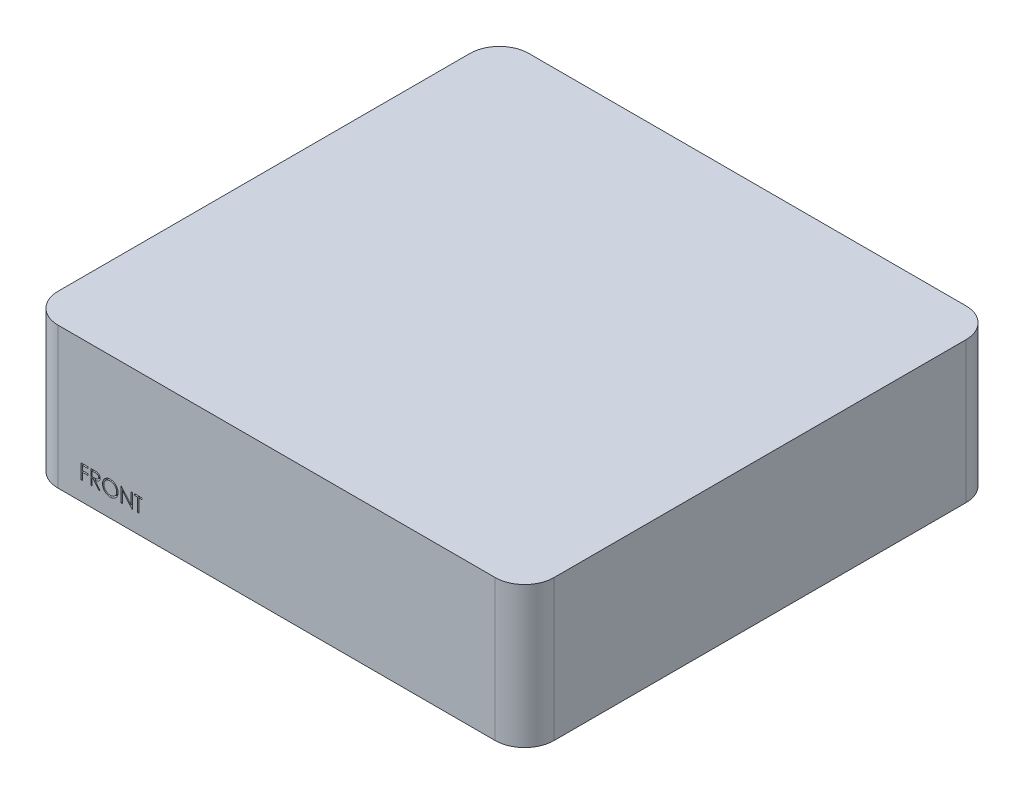
from build123d import *

# Parameters (mm, degrees)
SKETCH1_W           = 118
SKETCH1_H           = 112
BOSS_EXTRUDE1_DEPTH = 33.6
FILLET2_R           = 7
CUT_EXTRUDE1_DEPTH  = 1


with BuildPart() as part:
    # Sketch1 → Boss-Extrude1 (new body)
    with BuildSketch(Plane(origin=(0, 0, 0), x_dir=(1, 0, 0), z_dir=(0, 1, 0))):
        with Locations((59, 56)):
            Rectangle(SKETCH1_W, SKETCH1_H)
    extrude(amount=BOSS_EXTRUDE1_DEPTH)

    # Fillet2
    fillet2_edges = [part.edges().sort_by_distance(p)[0] for p in [
        (118, 16.8, 0),
        (118, 16.8, -112),
        (0, 16.8, -112),
        (0, 16.8, 0),
    ]]
    fillet(fillet2_edges, radius=FILLET2_R)

    # Sketch4 → Cut-Extrude1 (cut)
    # profile 1 of 5: a face of its own
    with BuildSketch(Plane.XY):
        Polygon((12.455172464, 7.97101264), (14.16030067, 7.97101264), (14.16030067, 7.612038281), (12.769275028, 7.612038281), (12.769275028, 6.535115204), (14.16030067, 6.535115204), (14.16030067, 6.176140845), (12.769275028, 6.176140845), (12.769275028, 4.47101264), (12.455172464, 4.47101264), align=None)
    # profile 2 of 5: a face of its own
    with BuildSketch(Plane.XY):
        with BuildLine():
            Line((14.788505798, 7.97101264), (15.488926471, 7.97101264))
            add(Edge.make_bspline(
                [(15.488926471, 7.97101264), (15.535667599, 7.970857054), (15.625415744, 7.970558311), (15.753989014, 7.968892548), (15.870816111, 7.964118193), (15.97583595, 7.960009609), (16.069046605, 7.952517668), (16.150733896, 7.945357021), (16.220521594, 7.93598336), (16.262767445, 7.927277937), (16.281895221, 7.923336358)],
                knots=[0, 0, 0, 0, 1.410062039, 2.707475311, 3.878576406, 4.937260626, 5.877586885, 6.699081471, 7.410979367, 8, 8, 8, 8], degree=3))
            add(Edge.make_bspline(
                [(16.281895221, 7.923336358), (16.307501845, 7.917009592), (16.358168834, 7.904491029), (16.4311189, 7.878031428), (16.500633224, 7.847411803), (16.566423049, 7.811448083), (16.62815884, 7.769873303), (16.686477151, 7.723405181), (16.741642614, 7.672297975), (16.791424244, 7.615263134), (16.838363296, 7.555426624), (16.877951922, 7.490722867), (16.912078402, 7.423061339), (16.939248919, 7.351753922), (16.961126893, 7.27749215), (16.976553132, 7.199603353), (16.98580432, 7.118442378), (16.986746175, 7.063084469), (16.987223746, 7.035015044)],
                knots=[0, 0, 0, 0, 1.027469482, 2.033020251, 3.019912614, 3.986113645, 4.951240523, 5.91722682, 6.890402269, 7.87763091, 8.8651537, 9.85103654, 10.82876324, 11.815024772, 12.821070561, 13.842952187, 14.906261191, 16, 16, 16, 16], degree=3))
            add(Edge.make_bspline(
                [(16.987223746, 7.035015044), (16.985754748, 6.988379939), (16.982888353, 6.897382771), (16.956163249, 6.76532189), (16.912386729, 6.642132575), (16.85206344, 6.527969937), (16.775243964, 6.425059292), (16.682919173, 6.334668836), (16.575037562, 6.259028924), (16.474608246, 6.206576119), (16.385894046, 6.172983211), (16.312860733, 6.149346852), (16.233193756, 6.131084886), (16.147656421, 6.114724755), (16.055892766, 6.10237306), (15.958122726, 6.093326466), (15.854276575, 6.087672417), (15.782937505, 6.086830412), (15.74623817, 6.086397255)],
                knots=[0, 0, 0, 0, 1.260483769, 2.459530307, 3.627416485, 4.787058657, 5.939039949, 7.08810263, 8.267026773, 9.491475466, 10.141966685, 10.831826277, 11.566392101, 12.351337768, 13.187381173, 14.07005841, 15.007169909, 16, 16, 16, 16], degree=3))
            Line((15.74623817, 6.086397255), (17.032095541, 4.47101264))
            Line((17.032095541, 4.47101264), (16.643674067, 4.47101264))
            Line((16.643674067, 4.47101264), (15.357816695, 6.086397255))
            Line((15.357816695, 6.086397255), (15.102608362, 6.086397255))
            Line((15.102608362, 6.086397255), (15.102608362, 4.47101264))
            Line((15.102608362, 4.47101264), (14.788505798, 4.47101264))
            Line((14.788505798, 4.47101264), (14.788505798, 7.97101264))
        make_face()
        with BuildLine():
            Line((15.102608362, 7.612038281), (15.102608362, 6.445371614))
            Line((15.102608362, 6.445371614), (15.743433682, 6.440463762))
            add(Edge.make_bspline(
                [(15.743433682, 6.440463762), (15.773353721, 6.440450525), (15.831347278, 6.440424868), (15.915247943, 6.444418645), (15.993368055, 6.448961963), (16.065408807, 6.455911308), (16.131402382, 6.46486738), (16.191315796, 6.476070364), (16.245246847, 6.489122427), (16.308145386, 6.509324053), (16.378381917, 6.541330071), (16.454713377, 6.58789557), (16.519715715, 6.646464689), (16.574633577, 6.713438145), (16.618763009, 6.787074394), (16.649875063, 6.866490763), (16.669617505, 6.949682361), (16.671946051, 7.006860469), (16.673121182, 7.035716165)],
                knots=[0, 0, 0, 0, 1.146690395, 2.22261258, 3.21895312, 4.145990853, 4.996080663, 5.770904154, 6.481378293, 7.121626537, 8.300444488, 9.431385265, 10.535395872, 11.636531494, 12.74115979, 13.810798291, 14.895190096, 16, 16, 16, 16], degree=3))
            add(Edge.make_bspline(
                [(16.673121182, 7.035716165), (16.671919061, 7.063862739), (16.669536896, 7.119638978), (16.650088127, 7.201294888), (16.617198746, 7.278361838), (16.572876508, 7.350526323), (16.518877353, 7.416032059), (16.45555954, 7.472079212), (16.384654345, 7.518328677), (16.318383147, 7.547883057), (16.259148934, 7.566002911), (16.207719274, 7.578754074), (16.149607797, 7.588998543), (16.084532338, 7.597206604), (16.012770707, 7.604261548), (15.933960056, 7.609013327), (15.848623276, 7.611827191), (15.789476345, 7.61196628), (15.758858362, 7.612038281)],
                knots=[0, 0, 0, 0, 1.101028733, 2.181837193, 3.264309656, 4.369019818, 5.486613113, 6.575447106, 7.666700264, 8.788928104, 9.402425223, 10.0903467, 10.862060571, 11.710948788, 12.657782767, 13.684531032, 14.801375019, 16, 16, 16, 16], degree=3))
            Line((15.758858362, 7.612038281), (15.102608362, 7.612038281))
        make_face(mode=Mode.SUBTRACT)
    # profile 3 of 5: a face of its own
    with BuildSketch(Plane.XY):
        with BuildLine():
            add(Edge.make_bspline(
                [(19.387864772, 8.060756229), (19.452672878, 8.05911475), (19.579961345, 8.055890749), (19.767036243, 8.031211646), (19.945631338, 7.988516256), (20.117201477, 7.931653273), (20.279694453, 7.855798888), (20.434333346, 7.764113739), (20.58075022, 7.655637281), (20.716971601, 7.531208054), (20.841628551, 7.3958246), (20.951454438, 7.25134669), (21.043496731, 7.098647888), (21.119082519, 6.938187057), (21.178381128, 6.770327089), (21.219300172, 6.594173086), (21.245438322, 6.410866396), (21.2484941, 6.285839531), (21.250044259, 6.222414883)],
                knots=[0, 0, 0, 0, 1.065120563, 2.091984664, 3.0946048, 4.079830382, 5.057816894, 6.036188127, 7.030412546, 8.04752943, 9.064399622, 10.05169764, 11.02544977, 11.989514704, 12.962713494, 13.945757189, 14.957906945, 16, 16, 16, 16], degree=3))
            add(Edge.make_bspline(
                [(21.250044259, 6.222414883), (21.248494327, 6.159457437), (21.24543923, 6.035361017), (21.219270453, 5.853217572), (21.178229453, 5.678126876), (21.119633186, 5.510381223), (21.044407708, 5.349803659), (20.951752537, 5.196816705), (20.842611326, 5.051370207), (20.718404475, 4.915057542), (20.583003433, 4.790060071), (20.437773166, 4.681141195), (20.285979846, 4.587417071), (20.125670138, 4.512633397), (19.958970101, 4.452861476), (19.784387778, 4.412108846), (19.602741224, 4.385821803), (19.47887022, 4.382803287), (19.415909644, 4.38126905)],
                knots=[0, 0, 0, 0, 1.043624062, 2.057103931, 3.04512605, 4.022047818, 4.998200453, 5.980619268, 6.982898556, 8.009068085, 9.034988726, 10.034168286, 11.015286542, 11.987931943, 12.962482838, 13.94673481, 14.956375938, 16, 16, 16, 16], degree=3))
            add(Edge.make_bspline(
                [(19.415909644, 4.38126905), (19.352485325, 4.382818437), (19.227459109, 4.385872691), (19.043922074, 4.412054096), (18.86764433, 4.452995399), (18.699129979, 4.511504836), (18.538285049, 4.587122066), (18.384794966, 4.679326445), (18.239275819, 4.788733587), (18.102934072, 4.912900161), (17.978184874, 5.048071713), (17.869425499, 5.192905968), (17.777200385, 5.344561425), (17.701837053, 5.503458949), (17.642172593, 5.668830392), (17.601467775, 5.841778869), (17.575131823, 6.021318375), (17.572096977, 6.143561273), (17.57055708, 6.20558796)],
                knots=[0, 0, 0, 0, 1.053102029, 2.075944431, 3.073151272, 4.055350789, 5.033113405, 6.020478099, 7.024410459, 8.052272461, 9.079885166, 10.07527673, 11.055994387, 12.023226415, 12.992069828, 13.970394897, 14.97016774, 16, 16, 16, 16], degree=3))
            add(Edge.make_bspline(
                [(17.57055708, 6.20558796), (17.571091715, 6.247220629), (17.572154242, 6.329960753), (17.584945934, 6.452827353), (17.603507635, 6.573718011), (17.630109548, 6.692288959), (17.664901215, 6.808249943), (17.705953242, 6.922400706), (17.756093088, 7.03358443), (17.812773736, 7.142327822), (17.876035544, 7.246935728), (17.945911293, 7.345815311), (18.019946662, 7.439796308), (18.101110055, 7.526443311), (18.1867265, 7.608276968), (18.278184879, 7.684039685), (18.374927123, 7.754414636), (18.477369503, 7.817834977), (18.582987778, 7.875194111), (18.691864555, 7.924415962), (18.802521127, 7.966662024), (18.915475775, 8.000902849), (19.030428547, 8.027934885), (19.147630331, 8.046342239), (19.266987758, 8.059166557), (19.347399077, 8.060224059), (19.387864772, 8.060756229)],
                knots=[0, 0, 0, 0, 1.037015668, 2.060948919, 3.074880161, 4.083647147, 5.086022904, 6.090072063, 7.104153813, 8.122640571, 9.144368836, 10.147691507, 11.138137339, 12.123020368, 13.103399296, 14.087645067, 15.080126199, 16.082011238, 17.087798457, 18.072939717, 19.057185487, 20.037253025, 21.01195951, 21.997135196, 22.992090687, 24, 24, 24, 24], degree=3))
        make_face()
        with BuildLine():
            add(Edge.make_bspline(
                [(19.403289452, 7.70178187), (19.370074818, 7.70137698), (19.303963085, 7.700571071), (19.205678549, 7.689955355), (19.108686615, 7.674825466), (19.012967253, 7.653243945), (18.918920963, 7.623839892), (18.825671122, 7.589998984), (18.734068068, 7.548777894), (18.644414211, 7.502205189), (18.557499135, 7.450656268), (18.475486434, 7.393684501), (18.39816379, 7.332625947), (18.325720523, 7.26733811), (18.258369351, 7.197488508), (18.19478465, 7.124136072), (18.137515068, 7.045184181), (18.085029491, 6.962773774), (18.038061651, 6.877012193), (17.996296296, 6.788802331), (17.962132287, 6.697424644), (17.934269911, 6.603870486), (17.9111701, 6.508288026), (17.896536176, 6.409952178), (17.885803817, 6.309357066), (17.885043971, 6.241375212), (17.884659644, 6.206990204)],
                knots=[0, 0, 0, 0, 1.008559885, 2.007477868, 2.99961109, 3.989939068, 4.984837346, 5.991145699, 7.001802488, 8.033829008, 9.059044045, 10.069351652, 11.065060232, 12.050310815, 13.029377138, 14.011219647, 14.996725999, 15.989392538, 16.977580475, 17.965360261, 18.951710183, 19.937753436, 20.929683414, 21.935841486, 22.955955122, 24, 24, 24, 24], degree=3))
            add(Edge.make_bspline(
                [(17.884659644, 6.206990204), (17.885934506, 6.156427983), (17.888442554, 6.056956453), (17.910400124, 5.911188309), (17.944222098, 5.771100023), (17.994079465, 5.637458113), (18.056430079, 5.50911383), (18.13345697, 5.387205726), (18.224716055, 5.271700851), (18.328379582, 5.163405582), (18.441702288, 5.064559778), (18.562035018, 4.977796369), (18.688088626, 4.90438612), (18.820191829, 4.844581047), (18.957639368, 4.797191309), (19.101316919, 4.764712678), (19.250267378, 4.743337223), (19.351798033, 4.741284467), (19.403289452, 4.740243409)],
                knots=[0, 0, 0, 0, 1.032063989, 2.030389145, 3.003944642, 3.970395727, 4.937377036, 5.913328081, 6.909231446, 7.93887556, 8.970685674, 9.976071282, 10.964166581, 11.944589148, 12.933237628, 13.927779006, 14.949070134, 16, 16, 16, 16], degree=3))
            add(Edge.make_bspline(
                [(19.403289452, 4.740243409), (19.437898953, 4.740718913), (19.50653999, 4.741661981), (19.608635512, 4.751160658), (19.708891724, 4.766392528), (19.807168004, 4.788323183), (19.903352815, 4.81577039), (19.997847618, 4.848378118), (20.089645908, 4.889059321), (20.179905746, 4.934007273), (20.266301988, 4.98524743), (20.34877752, 5.04028558), (20.4252535, 5.101254201), (20.497642571, 5.165572013), (20.56527026, 5.234535861), (20.627679245, 5.308056083), (20.684659377, 5.38659674), (20.737125023, 5.468882146), (20.783928286, 5.554878399), (20.824707385, 5.643408077), (20.859303501, 5.734253186), (20.887232006, 5.827544757), (20.909117468, 5.923105606), (20.924197387, 6.021063684), (20.934745826, 6.121223027), (20.935540903, 6.188966883), (20.935941695, 6.223116005)],
                knots=[0, 0, 0, 0, 1.047197238, 2.076906641, 3.100256066, 4.114471768, 5.12198147, 6.126382909, 7.136867548, 8.15857795, 9.17633901, 10.174870724, 11.156907918, 12.133735059, 13.104061851, 14.077631395, 15.04955518, 16.038496417, 17.029181396, 18.010275684, 18.986308667, 19.968651475, 20.955262928, 21.950658345, 22.966943676, 24, 24, 24, 24], degree=3))
            add(Edge.make_bspline(
                [(20.935941695, 6.223116005), (20.935540582, 6.257031509), (20.934744901, 6.32430916), (20.924202426, 6.423769978), (20.909101536, 6.521023189), (20.887338828, 6.615686992), (20.859288674, 6.707785517), (20.824701344, 6.797232265), (20.783916044, 6.88436046), (20.73710782, 6.968954757), (20.684491996, 7.050129495), (20.626997753, 7.127731908), (20.563632405, 7.200304649), (20.49620638, 7.269639343), (20.423035495, 7.334257233), (20.3444512, 7.394179753), (20.261407523, 7.450853028), (20.173480287, 7.501978589), (20.082736334, 7.549192822), (19.989622376, 7.589643825), (19.895193276, 7.624015945), (19.799689164, 7.65333291), (19.702306185, 7.67474094), (19.603702356, 7.68996899), (19.504014098, 7.700567376), (19.436970878, 7.701375754), (19.403289452, 7.70178187)],
                knots=[0, 0, 0, 0, 1.02996197, 2.043119294, 3.035359645, 4.018872909, 4.991431989, 5.957985074, 6.929999688, 7.912076566, 8.892894881, 9.867085534, 10.843653904, 11.817741046, 12.803660682, 13.806313499, 14.818574707, 15.856120519, 16.894564902, 17.924820532, 18.937903209, 19.946497019, 20.957711757, 21.963978472, 22.977135795, 24, 24, 24, 24], degree=3))
        make_face(mode=Mode.SUBTRACT)
    # profile 4 of 5: a face of its own
    with BuildSketch(Plane.XY):
        Polygon((21.967992977, 4.47101264), (21.967992977, 7.97101264), (22.033898426, 7.97101264), (24.346198105, 5.216305108), (24.346198105, 7.97101264), (24.66030067, 7.97101264), (24.66030067, 4.47101264), (24.588786246, 4.47101264), (22.282095541, 7.219410076), (22.282095541, 4.47101264), align=None)
    # profile 5 of 5: a face of its own
    with BuildSketch(Plane.XY):
        Polygon((25.153890413, 7.612038281), (25.153890413, 7.97101264), (26.993634003, 7.97101264), (26.993634003, 7.612038281), (26.23081349, 7.612038281), (26.23081349, 4.47101264), (25.916710926, 4.47101264), (25.916710926, 7.612038281), align=None)
    extrude(amount=-CUT_EXTRUDE1_DEPTH, mode=Mode.SUBTRACT)


solid = part.part
